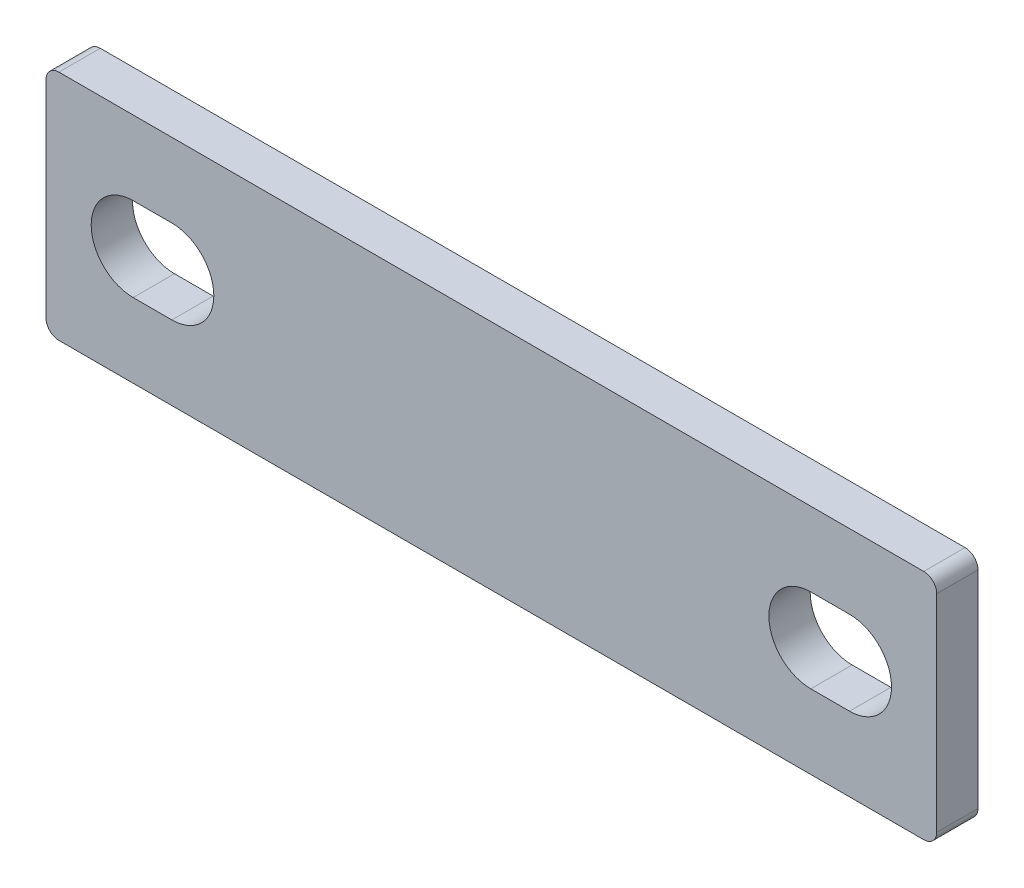
from build123d import *

# Parameters (mm, degrees)
ESTRUSIONE_ESTRUSIONE1_DEPTH = 6.4


with BuildPart() as part:
    # Schizzo1 → Estrusione-Estrusione1 (new body)
    with BuildSketch(Plane.XY):
        with BuildLine():
            Line((0, -34), (0, -2))
            ThreePointArc((0, -2), (-0.585786438, -0.585786438), (-2, 0))
            Line((-2, 0), (-40, 0))
            Line((-40, 0), (-98, 0))
            Line((-98, 0), (-136, 0))
            ThreePointArc((-136, 0), (-137.414213562, -0.585786438), (-138, -2))
            Line((-138, -2), (-138, -34))
            ThreePointArc((-138, -34), (-137.414213562, -35.414213562), (-136, -36))
            Line((-136, -36), (-98, -36))
            Line((-98, -36), (-40, -36))
            Line((-40, -36), (-2, -36))
            ThreePointArc((-2, -36), (-0.585786438, -35.414213562), (0, -34))
        make_face()
        with BuildLine():
            Line((-19.5, -24.5), (-13.5, -24.5))
            ThreePointArc((-13.5, -24.5), (-7, -18), (-13.5, -11.5))
            Line((-13.5, -11.5), (-19.5, -11.5))
            ThreePointArc((-19.5, -11.5), (-26, -18), (-19.5, -24.5))
        make_face(mode=Mode.SUBTRACT)
        with BuildLine():
            Line((-124.5, -24.5), (-118.5, -24.5))
            ThreePointArc((-118.5, -24.5), (-112, -18), (-118.5, -11.5))
            Line((-118.5, -11.5), (-124.5, -11.5))
            ThreePointArc((-124.5, -11.5), (-131, -18), (-124.5, -24.5))
        make_face(mode=Mode.SUBTRACT)
    extrude(amount=ESTRUSIONE_ESTRUSIONE1_DEPTH)


solid = part.part
